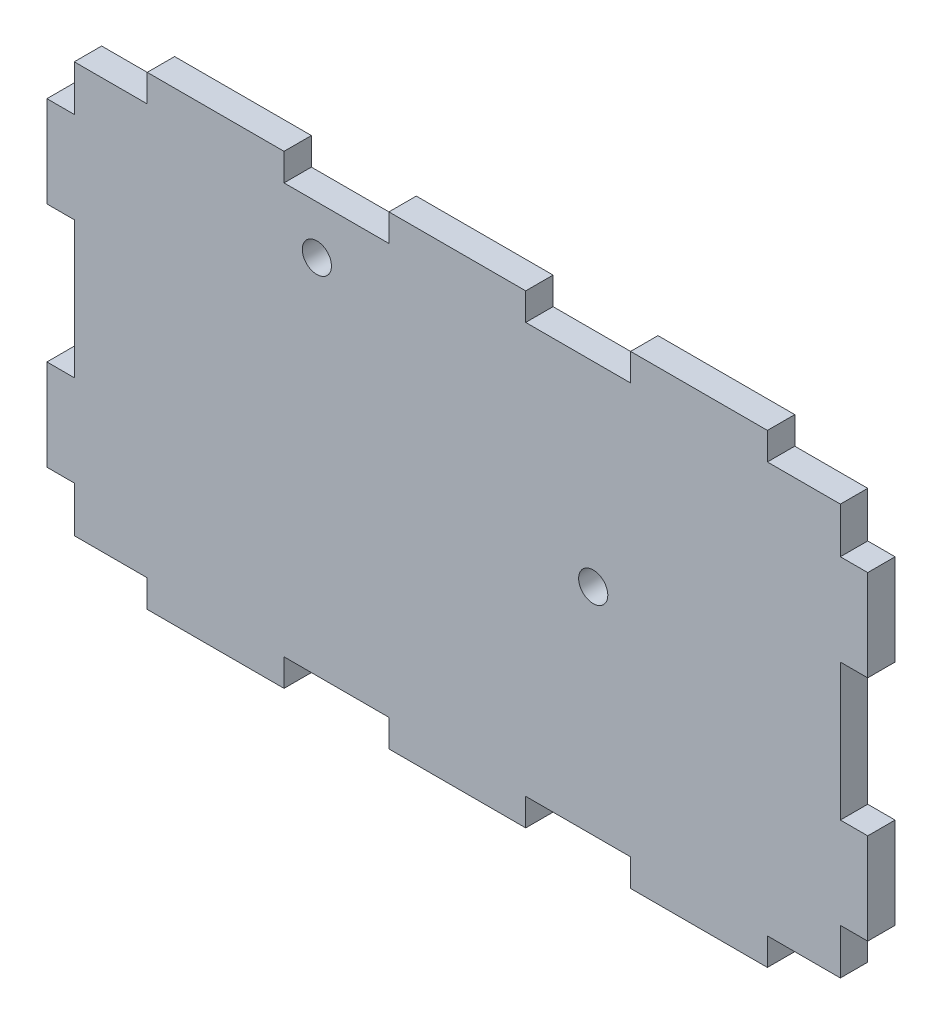
from build123d import *

# Parameters (mm, degrees)
EXTRUDE_1_DEPTH     = 3
SKETCH_3_R          = 1.6
CUT_EXTRUDE_1_DEPTH = 52.809748118


with BuildPart() as part:
    # 草图1 → 凸台-拉伸1 (new body)
    with BuildSketch(Plane.XY):
        Polygon((-42, -22.5), (-34, -22.5), (-34, -25.5), (-19, -25.5), (-19, -22.5), (-7.5, -22.5), (-7.5, -25.5), (7.5, -25.5), (7.5, -22.5), (19, -22.5), (19, -25.5), (34, -25.5), (34, -22.5), (42, -22.5), (42, -17.5), (45, -17.5), (45, -7.5), (42, -7.5), (42, 7.5), (45, 7.5), (45, 17.5), (42, 17.5), (42, 22.5), (34, 22.5), (34, 25.5), (19, 25.5), (19, 22.5), (7.5, 22.5), (7.5, 25.5), (-7.5, 25.5), (-7.5, 22.5), (-19, 22.5), (-19, 25.5), (-34, 25.5), (-34, 22.5), (-42, 22.5), (-42, 17.5), (-45, 17.5), (-45, 7.5), (-42, 7.5), (-42, -7.5), (-45, -7.5), (-45, -17.5), (-42, -17.5), align=None)
    extrude(amount=EXTRUDE_1_DEPTH)

    # 草图3 → 切除-拉伸1 (cut, through all)
    with BuildSketch(Plane.XY.offset(3)):
        with Locations((-15.4, 17.2)):
            Circle(SKETCH_3_R)
        with Locations((14.9, 1.1)):
            Circle(SKETCH_3_R)
    extrude(amount=-CUT_EXTRUDE_1_DEPTH, mode=Mode.SUBTRACT)


solid = part.part
